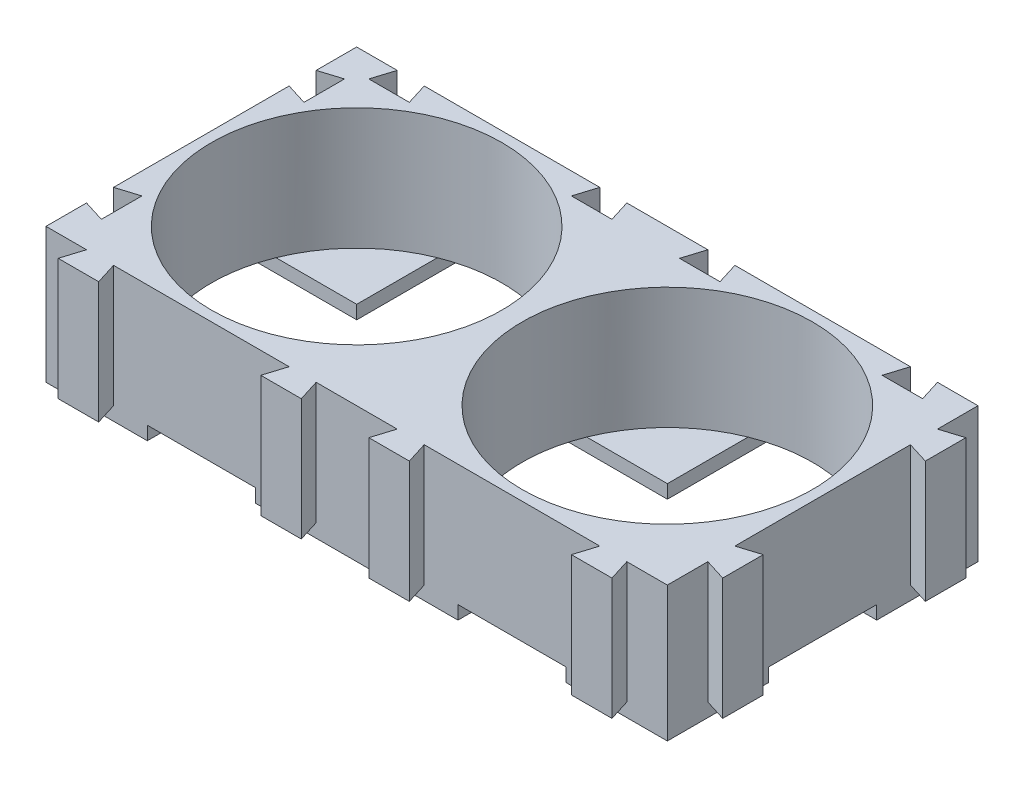
from build123d import *

# Parameters (mm, degrees)
SKETCH1_W           = 47.6
SKETCH1_H           = 24.6
BOSS_EXTRUDE1_DEPTH = 10
SKETCH2_R           = 10.75
CUT_EXTRUDE1_DEPTH  = 9
CUT_EXTRUDE2_DEPTH  = 9
SKETCH5_W           = 1.6
SKETCH5_H           = 24.6
CUT_EXTRUDE3_DEPTH  = 10
SKETCH6_W           = 46
SKETCH6_H           = 1.6
CUT_EXTRUDE4_DEPTH  = 10
BOSS_EXTRUDE2_DEPTH = 9
SKETCH10_W          = 46
SKETCH10_H          = 8.003908937
CUT_EXTRUDE5_DEPTH  = 1
SKETCH11_W          = 8
SKETCH11_H          = 23
CUT_EXTRUDE6_DEPTH  = 1


with BuildPart() as part:
    # Sketch1 → Boss-Extrude1 (new body)
    with BuildSketch(Plane(origin=(0, 0, 0), x_dir=(1, 0, 0), z_dir=(0, 1, 0))):
        with Locations((23.8, 12.3)):
            Rectangle(SKETCH1_W, SKETCH1_H)
    extrude(amount=BOSS_EXTRUDE1_DEPTH)

    # Sketch2 → Cut-Extrude1 (cut)
    with BuildSketch(Plane(origin=(0, 10, 0), x_dir=(1, 0, 0), z_dir=(0, 1, 0))):
        with Locations(Location((11.5, 13.1, 0), (0, 0, 270))):
            Circle(SKETCH2_R)
        with Locations(Location((34.5, 13.1, 0), (0, 0, 270))):
            Circle(SKETCH2_R)
    extrude(amount=-CUT_EXTRUDE1_DEPTH, mode=Mode.SUBTRACT)

    # Sketch3 → Cut-Extrude2 (cut)
    with BuildSketch(Plane(origin=(0, 10, 0), x_dir=(1, 0, 0), z_dir=(0, 1, 0))):
        Polygon((3, 24.6), (2.5, 23), (5.5, 23), (5, 24.6), align=None)
        Polygon((18, 24.6), (17.5, 23), (20.5, 23), (20, 24.6), align=None)
        Polygon((26, 24.6), (25.5, 23), (28.5, 23), (28, 24.6), align=None)
        Polygon((41, 24.6), (40.5, 23), (43.5, 23), (43, 24.6), align=None)
        Polygon((0, 21.6), (1.6, 22.1), (1.6, 19.1), (0, 19.6), align=None)
        Polygon((0, 6.6), (1.6, 7.1), (1.6, 4.1), (0, 4.6), align=None)
    extrude(amount=-CUT_EXTRUDE2_DEPTH, mode=Mode.SUBTRACT)

    # Sketch5 → Cut-Extrude3 (cut)
    with BuildSketch(Plane(origin=(0, 10, 0), x_dir=(1, 0, 0), z_dir=(0, 1, 0))):
        with Locations((46.8, 12.3)):
            Rectangle(SKETCH5_W, SKETCH5_H)
    extrude(amount=-CUT_EXTRUDE3_DEPTH, mode=Mode.SUBTRACT)

    # Sketch6 → Cut-Extrude4 (cut)
    with BuildSketch(Plane(origin=(0, 10, 0), x_dir=(1, 0, 0), z_dir=(0, 1, 0))):
        with Locations((23, 0.8)):
            Rectangle(SKETCH6_W, SKETCH6_H)
    extrude(amount=-CUT_EXTRUDE4_DEPTH, mode=Mode.SUBTRACT)

    # Sketch7 → Boss-Extrude2 (add)
    with BuildSketch(Plane(origin=(0, 10, 0), x_dir=(1, 0, 0), z_dir=(0, 1, 0))):
        Polygon((46, 21.6), (47.6, 22.1), (47.6, 19.1), (46, 19.6), align=None)
        Polygon((46, 6.6), (47.6, 7.1), (47.6, 4.1), (46, 4.6), align=None)
        Polygon((3, 1.6), (2.5, 0), (5.5, 0), (5, 1.6), align=None)
        Polygon((18, 1.6), (17.5, 0), (20.5, 0), (20, 1.6), align=None)
        Polygon((26, 1.6), (25.5, 0), (28.5, 0), (28, 1.6), align=None)
        Polygon((41, 1.6), (40.5, 0), (43.5, 0), (43, 1.6), align=None)
    extrude(amount=-BOSS_EXTRUDE2_DEPTH)

    # Sketch10 → Cut-Extrude5 (cut)
    with BuildSketch(Plane.XZ):
        with Locations((23, -13.101954469)):
            Rectangle(SKETCH10_W, SKETCH10_H)
    extrude(amount=-CUT_EXTRUDE5_DEPTH, mode=Mode.SUBTRACT)

    # Sketch11 → Cut-Extrude6 (cut)
    with BuildSketch(Plane.XZ):
        with Locations((11.5, -13.1)):
            Rectangle(SKETCH11_W, SKETCH11_H)
        with Locations((34.5, -13.1)):
            Rectangle(SKETCH11_W, SKETCH11_H)
    extrude(amount=-CUT_EXTRUDE6_DEPTH, mode=Mode.SUBTRACT)


solid = part.part
